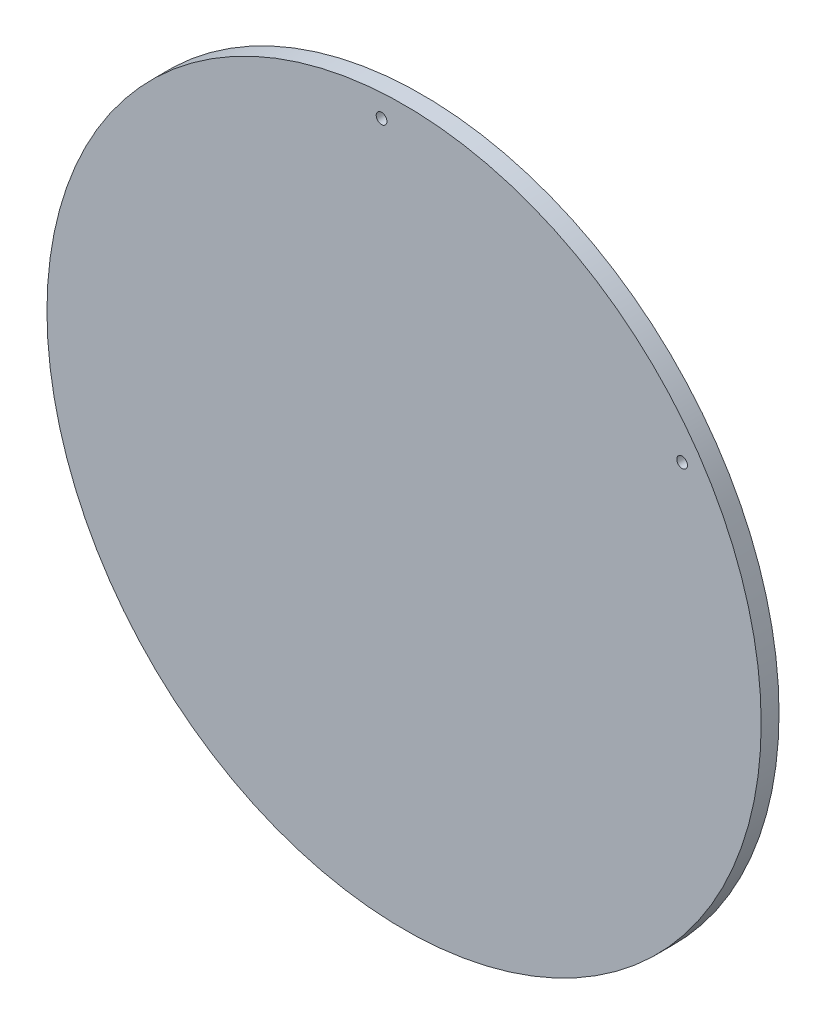
from build123d import *

# Parameters (mm, degrees)
SKETCH1_R           = 200
SKETCH1_R_2         = 3
BOSS_EXTRUDE1_DEPTH = 10
SCALE1_SCALE        = 10


with BuildPart() as part:
    # Sketch1 → Boss-Extrude1 (new body)
    with BuildSketch(Plane.XY):
        Circle(SKETCH1_R)
        with Locations((155.706340136, 104.459492826)):
            Circle(SKETCH1_R_2, mode=Mode.SUBTRACT)
        with Locations((-12.611404385, 187.075392501)):
            Circle(SKETCH1_R_2, mode=Mode.SUBTRACT)
    extrude(amount=BOSS_EXTRUDE1_DEPTH)


with BuildPart() as part_1:
    # Scale1: scaled about (-0.032210855, -0.06562488, 5)
    add(part.part.scale(SCALE1_SCALE).moved(Location((0.289897695, 0.59062392, -45))))


solid = part_1.part
